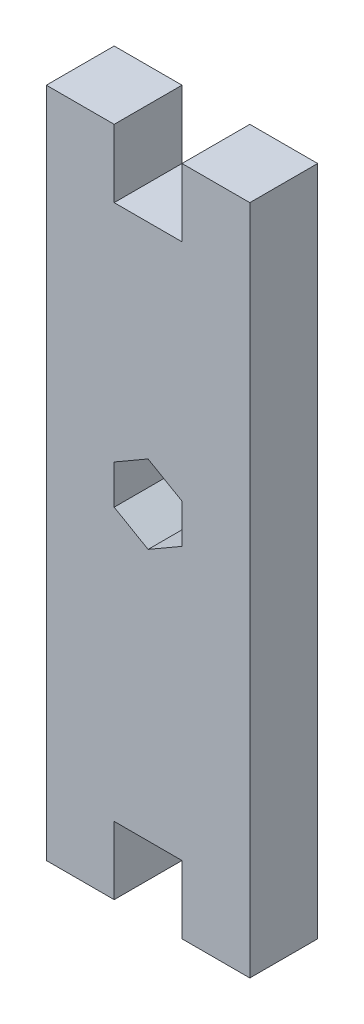
from build123d import *

# Parameters (mm, degrees)
BOSS_EXTRU_1_DEPTH = 5
CUT_EXTRUDE1_DEPTH = 10


with BuildPart() as part:
    # Esquisse1 → Boss.-Extru.1 (new body)
    with BuildSketch(Plane.XY):
        Polygon((3.468077367, 2.92543021), (8.468077367, 2.92543021), (8.468077367, -46.57456979), (3.468077367, -46.57456979), (3.468077367, -41.57456979), (-1.531922633, -41.57456979), (-1.531922633, -46.57456979), (-6.531922633, -46.57456979), (-6.531922633, 2.92543021), (-1.531922633, 2.92543021), (-1.531922633, -2.07456979), (3.468077367, -2.07456979), align=None)
    extrude(amount=BOSS_EXTRU_1_DEPTH)

    # Esquisse2 → Cut-Extrude1 (cut)
    with BuildSketch(Plane(origin=(0, 0, 0), x_dir=(-1, 0, 0), z_dir=(0, 0, -1))):
        Polygon((-3.468077367, -21.517945463), (-0.968077367, -22.961321136), (1.531922633, -21.517945463), (1.531922633, -18.631194117), (-0.968077367, -17.187818444), (-3.468077367, -18.631194117), align=None)
    extrude(amount=-CUT_EXTRUDE1_DEPTH, mode=Mode.SUBTRACT)


solid = part.part
